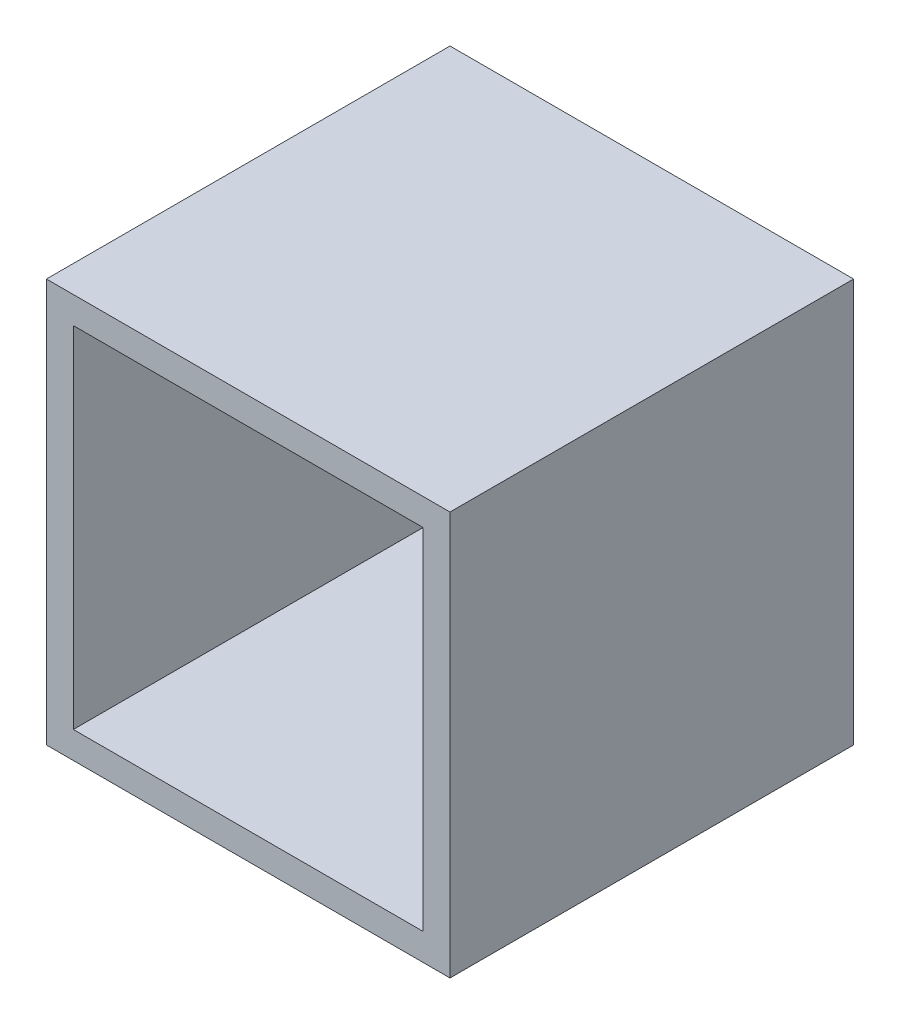
from build123d import *

# Parameters (mm, degrees)
SKETCH_1_W          = 30
SKETCH_1_H          = 30
EXTRUDE_1_DEPTH     = 30
SKETCH_2_W          = 26
SKETCH_2_H          = 26
CUT_EXTRUDE_1_DEPTH = 52.961524227


with BuildPart() as part:
    # Эскиз1 → Бобышка-Вытянуть1 (new body)
    with BuildSketch(Plane.XY):
        with Locations((15, 15)):
            Rectangle(SKETCH_1_W, SKETCH_1_H)
    extrude(amount=EXTRUDE_1_DEPTH)

    # Эскиз2 → Вырез-Вытянуть1 (cut, through all)
    with BuildSketch(Plane.XY.offset(30)):
        with Locations((15, 15)):
            Rectangle(SKETCH_2_W, SKETCH_2_H)
    extrude(amount=-CUT_EXTRUDE_1_DEPTH, mode=Mode.SUBTRACT)


solid = part.part
